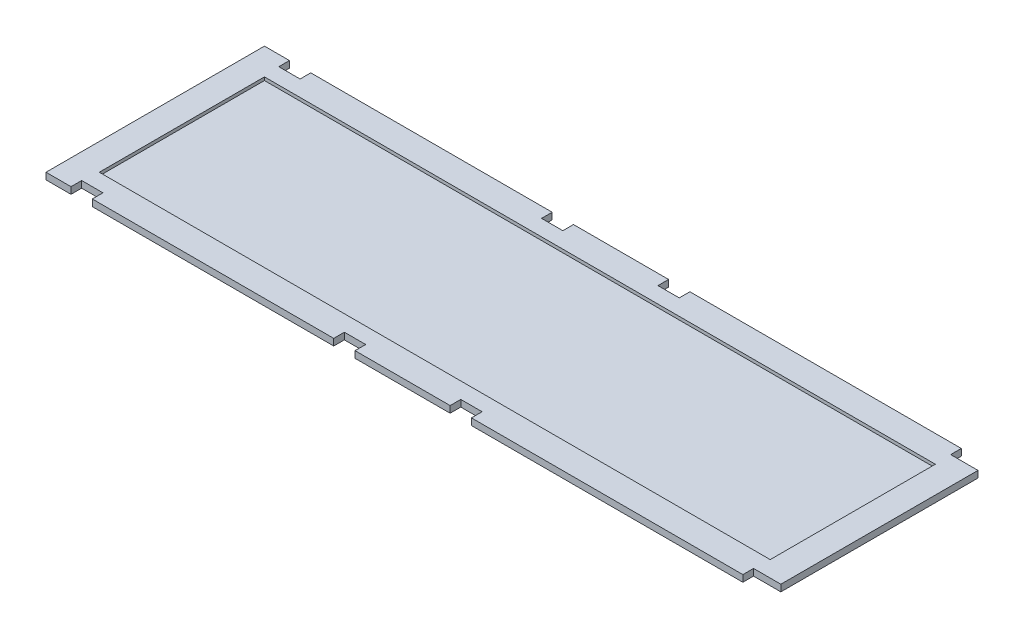
from build123d import *

# Parameters (mm, degrees)
BOSS_EXTRUDE1_DEPTH = 1.25
SKETCH2_W           = 125.92
SKETCH2_H           = 31
CUT_EXTRUDE1_DEPTH  = 0.6


with BuildPart() as part:
    # Sketch1 → Boss-Extrude1 (new body)
    with BuildSketch(Plane(origin=(0, 0, 0), x_dir=(1, 0, 0), z_dir=(0, 1, 0))):
        Polygon((8.69, 0), (54, 0), (54, 2), (58, 2), (58, 0), (75.85, 0), (75.85, 2), (79.85, 2), (79.85, 0), (130.79, 0), (130.79, 2), (135.92, 2), (135.92, 39), (130.79, 39), (130.79, 41), (79.85, 41), (79.85, 39), (75.85, 39), (75.85, 41), (58, 41), (58, 39), (54, 39), (54, 41), (8.69, 41), (8.69, 39), (4.69, 39), (4.69, 41), (0, 41), (0, 0), (4.69, 0), (4.69, 2), (8.69, 2), align=None)
    extrude(amount=BOSS_EXTRUDE1_DEPTH)

    # Sketch2 → Cut-Extrude1 (cut)
    with BuildSketch(Plane(origin=(0, 1.25, 0), x_dir=(1, 0, 0), z_dir=(0, 1, 0))):
        with Locations((67.96, 20.5)):
            Rectangle(SKETCH2_W, SKETCH2_H)
    extrude(amount=-CUT_EXTRUDE1_DEPTH, mode=Mode.SUBTRACT)


solid = part.part
